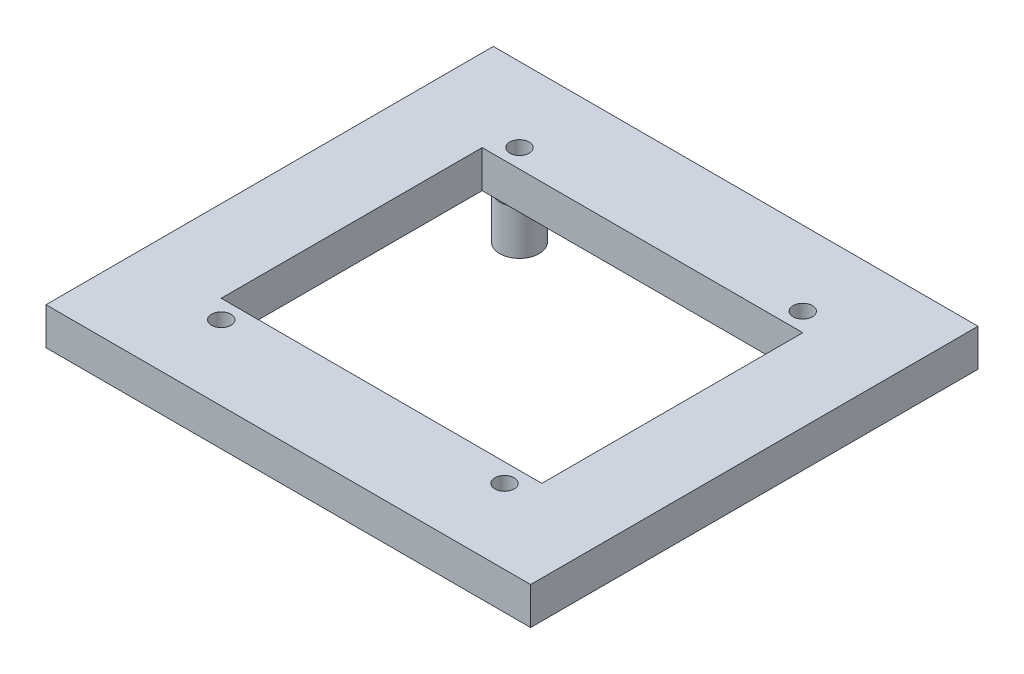
from build123d import *

# Parameters (mm, degrees)
SKETCH3_W           = 65
SKETCH3_H           = 60
BOSS_EXTRUDE3_DEPTH = 5
SKETCH5_W           = 43
SKETCH5_H           = 35
CUT_EXTRUDE2_DEPTH  = 10
CUT_EXTRUDE1_REACH  = 57.982
SKETCH4_R           = 1.3
SKETCH9_R           = 2.65
SKETCH9_R_2         = 1.05
BOSS_EXTRUDE5_DEPTH = 6


with BuildPart() as part:
    # Sketch3 → Boss-Extrude3 (new body)
    with BuildSketch(Plane(origin=(0, 0, 0), x_dir=(1, 0, 0), z_dir=(0, 1, 0))):
        with Locations((-14.5, 0)):
            Rectangle(SKETCH3_W, SKETCH3_H)
    extrude(amount=BOSS_EXTRUDE3_DEPTH)

    # Sketch5 → Cut-Extrude2 (cut)
    with BuildSketch(Plane.XZ):
        with Locations((-14.5, 0)):
            Rectangle(SKETCH5_W, SKETCH5_H)
    extrude(amount=-CUT_EXTRUDE2_DEPTH, mode=Mode.SUBTRACT)

    # Sketch4 → Cut-Extrude1 (cut, up to next)
    with BuildSketch(Plane(origin=(0, 5, 0), x_dir=(1, 0, 0), z_dir=(0, 1, 0)), mode=Mode.PRIVATE) as cut_extrude1_sk1:
        with Locations(Location((-33.5, 20, 0), (0, 0, 270))):
            Circle(SKETCH4_R)
    cut_extrude1_tool1 = extrude(cut_extrude1_sk1.sketch, amount=-CUT_EXTRUDE1_REACH, mode=Mode.PRIVATE) & part.part
    # Sketch4 → Cut-Extrude1 (cut, up to next)
    with BuildSketch(Plane(origin=(0, 5, 0), x_dir=(1, 0, 0), z_dir=(0, 1, 0)), mode=Mode.PRIVATE) as cut_extrude1_sk2:
        with Locations(Location((4.5, 20, 0), (0, 0, 270))):
            Circle(SKETCH4_R)
    cut_extrude1_tool2 = extrude(cut_extrude1_sk2.sketch, amount=-CUT_EXTRUDE1_REACH, mode=Mode.PRIVATE) & part.part
    # Sketch4 → Cut-Extrude1 (cut, up to next)
    with BuildSketch(Plane(origin=(0, 5, 0), x_dir=(1, 0, 0), z_dir=(0, 1, 0)), mode=Mode.PRIVATE) as cut_extrude1_sk3:
        with Locations(Location((4.5, -20, 0), (0, 0, 270))):
            Circle(SKETCH4_R)
    cut_extrude1_tool3 = extrude(cut_extrude1_sk3.sketch, amount=-CUT_EXTRUDE1_REACH, mode=Mode.PRIVATE) & part.part
    # Sketch4 → Cut-Extrude1 (cut, up to next)
    with BuildSketch(Plane(origin=(0, 5, 0), x_dir=(1, 0, 0), z_dir=(0, 1, 0)), mode=Mode.PRIVATE) as cut_extrude1_sk4:
        with Locations(Location((-33.5, -20, 0), (0, 0, 270))):
            Circle(SKETCH4_R)
    cut_extrude1_tool4 = extrude(cut_extrude1_sk4.sketch, amount=-CUT_EXTRUDE1_REACH, mode=Mode.PRIVATE) & part.part
    add(cut_extrude1_tool1.solids().sort_by_distance((-33.5, 5, -20))[0], mode=Mode.SUBTRACT)
    add(cut_extrude1_tool2.solids().sort_by_distance((4.5, 5, -20))[0], mode=Mode.SUBTRACT)
    add(cut_extrude1_tool3.solids().sort_by_distance((4.5, 5, 20))[0], mode=Mode.SUBTRACT)
    add(cut_extrude1_tool4.solids().sort_by_distance((-33.5, 5, 20))[0], mode=Mode.SUBTRACT)

    # Sketch9 → Boss-Extrude5 (add)
    # profile 1 of 4: a face of its own
    with BuildSketch(Plane.XZ):
        with Locations(Location((-33.5, 20, 0), (0, 0, 250.629961754))):
            Circle(SKETCH9_R)
        with Locations(Location((-33.5, 20, 0), (0, 0, 270))):
            Circle(SKETCH9_R_2, mode=Mode.SUBTRACT)
    # profile 2 of 4: a face of its own
    with BuildSketch(Plane.XZ):
        with Locations(Location((-33.5, -20, 0), (0, 0, 109.370038246))):
            Circle(SKETCH9_R)
        with Locations(Location((-33.5, -20, 0), (0, 0, 270))):
            Circle(SKETCH9_R_2, mode=Mode.SUBTRACT)
    # profile 3 of 4: a face of its own
    with BuildSketch(Plane.XZ):
        with Locations(Location((4.5, 20, 0), (0, 0, 289.370038246))):
            Circle(SKETCH9_R)
        with Locations(Location((4.5, 20, 0), (0, 0, 270))):
            Circle(SKETCH9_R_2, mode=Mode.SUBTRACT)
    # profile 4 of 4: a face of its own
    with BuildSketch(Plane.XZ):
        with Locations(Location((4.5, -20, 0), (0, 0, 109.370038246))):
            Circle(SKETCH9_R)
        with Locations(Location((4.5, -20, 0), (0, 0, 270))):
            Circle(SKETCH9_R_2, mode=Mode.SUBTRACT)
    extrude(amount=BOSS_EXTRUDE5_DEPTH)


solid = part.part
